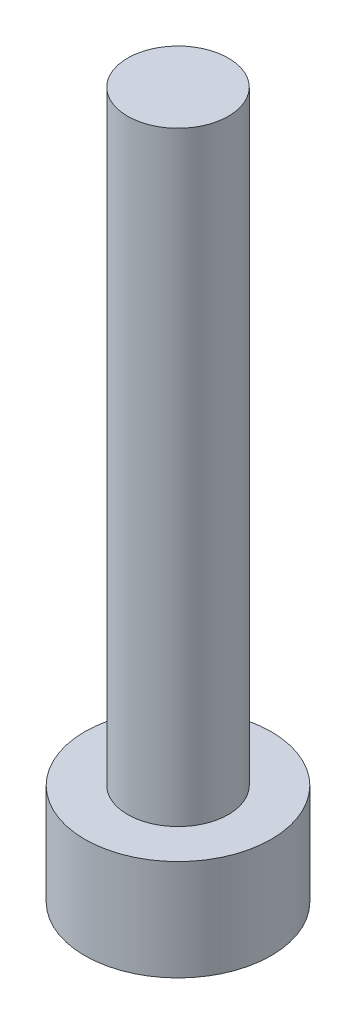
from build123d import *

# Parameters (mm, degrees)
SKETCH1_R           = 1.85
BOSS_EXTRUDE1_DEPTH = 2
SKETCH2_R           = 1
BOSS_EXTRUDE2_DEPTH = 12


with BuildPart() as part:
    # Sketch1 → Boss-Extrude1 (new body)
    with BuildSketch(Plane(origin=(0, 0, 0), x_dir=(1, 0, 0), z_dir=(0, 1, 0))):
        with Locations(Location((0, 0, 0), (0, 0, 270))):
            Circle(SKETCH1_R)
    extrude(amount=BOSS_EXTRUDE1_DEPTH)

    # Sketch2 → Boss-Extrude2 (add)
    with BuildSketch(Plane(origin=(0, 2, 0), x_dir=(1, 0, 0), z_dir=(0, 1, 0))):
        with Locations(Location((0, 0, 0), (0, 0, 270))):
            Circle(SKETCH2_R)
    extrude(amount=BOSS_EXTRUDE2_DEPTH)


solid = part.part
